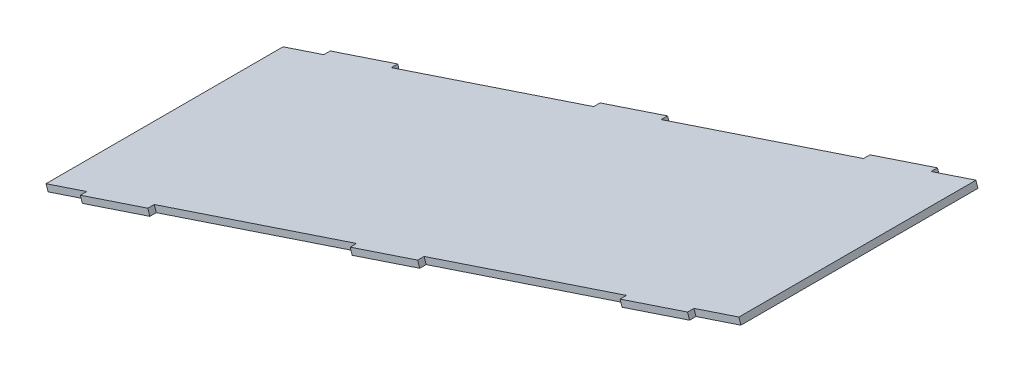
from build123d import *

# Parameters (mm, degrees)
BOSS_EXTRUDE1_DEPTH = 50
SKETCH2_W           = 30
SKETCH2_H           = 2.7
BOSS_EXTRUDE2_DEPTH = 2.7
SKETCH3_W           = 2.743497838
SKETCH3_H           = 100
CUT_EXTRUDE1_DEPTH  = 50
CUT_EXTRUDE2_DEPTH  = 331.140027497


with BuildPart() as part:
    # Sketch1 → Boss-Extrude1 (new body)
    with BuildSketch(Plane.XY):
        Polygon((-300, 0), (-299.146185032, -2.561444905), (0.853814968, 97.438555095), (0, 100), align=None)
    boss_extrude1 = extrude(amount=BOSS_EXTRUDE1_DEPTH)

    # Sketch2 → Boss-Extrude2 (add)
    with BuildSketch(Plane(origin=(-30, 90, 0), x_dir=(0.9486832980505159, 0.3162277660168317, 0), z_dir=(-0.3162277660168318, 0.948683298050516, 0))):
        with Locations((-3.377223398, 1.35)):
            Rectangle(SKETCH2_W, SKETCH2_H)
        with Locations((-123.377223398, 1.35)):
            Rectangle(SKETCH2_W, SKETCH2_H)
        with Locations((-243.377223398, 1.35)):
            Rectangle(SKETCH2_W, SKETCH2_H)
    boss_extrude2 = extrude(amount=-BOSS_EXTRUDE2_DEPTH)

    # Mirror1: Boss-Extrude1 across plane
    add(boss_extrude1.mirror(Plane.XY.offset(50)))

    # Mirror2: Boss-Extrude2 across plane
    add(boss_extrude2.mirror(Plane.XY.offset(50)))

    # Sketch3 → Cut-Extrude1 (cut)
    with BuildSketch(Plane(origin=(-30, 90, 0), x_dir=(0.9486832980505159, 0.3162277660168317, 0), z_dir=(-0.3162277660168318, 0.948683298050516, 0))):
        with Locations((-283.233240496, -50)):
            Rectangle(SKETCH3_W, SKETCH3_H)
    extrude(amount=-CUT_EXTRUDE1_DEPTH, mode=Mode.SUBTRACT)

    # Sketch4 → Cut-Extrude2 (cut, through all)
    with BuildSketch(Plane(origin=(0, 0, 0), x_dir=(-1, 0, 0), z_dir=(0, 0, -1))):
        Polygon((296.543474454, -1.693874712), (297.108099358, 0), (297.397289422, 0.867570193), (292.315665286, 2.561444905), (291.461850318, 0), align=None)
    extrude(amount=-CUT_EXTRUDE2_DEPTH, mode=Mode.SUBTRACT)


solid = part.part
